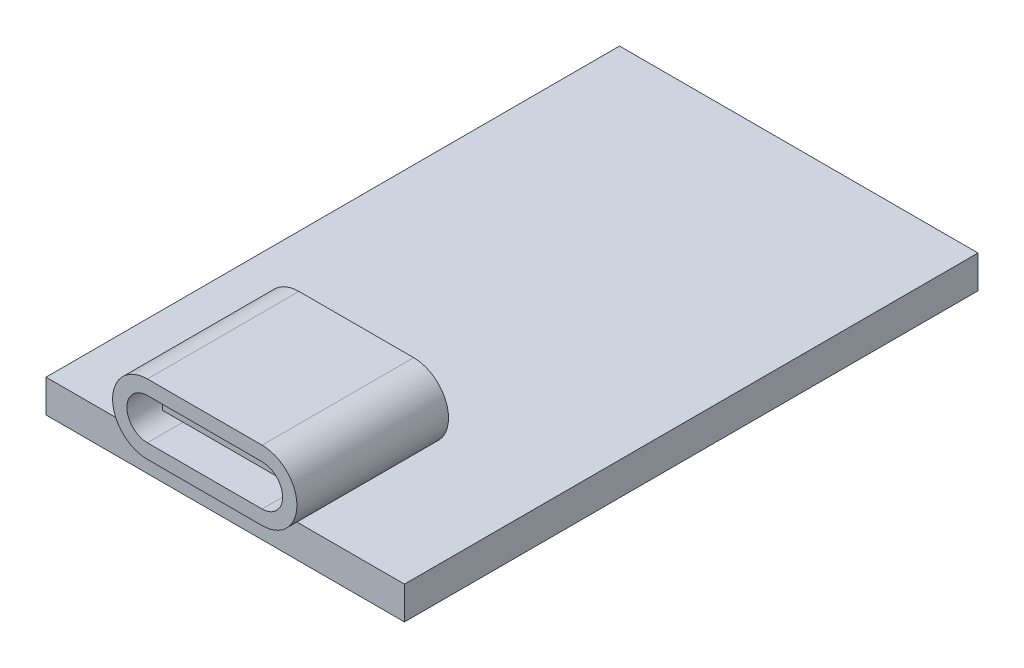
from build123d import *

# Parameters (mm, degrees)
SKETCH1_W                = 17.5
SKETCH1_H                = 28
BOSS_EXTRUDE1_DEPTH      = 1.6
BOSS_EXTRUDE2_DEPTH      = 1
BOSS_EXTRUDE2_DEPTH_BACK = 6.4
CUT_EXTRUDE1_DEPTH       = 6
SKETCH4_W                = 6.110016504
SKETCH4_H                = 0.488801321
BOSS_EXTRUDE3_DEPTH      = 5


with BuildPart() as part:
    # Sketch1 → Boss-Extrude1 (new body)
    with BuildSketch(Plane(origin=(0, 0, 0), x_dir=(1, 0, 0), z_dir=(0, 1, 0))):
        with Locations((8.75, 14)):
            Rectangle(SKETCH1_W, SKETCH1_H)
    extrude(amount=BOSS_EXTRUDE1_DEPTH)

    # Sketch2 → Boss-Extrude2 (add, two sides: drawn at the far end of the back side and taken through both)
    with BuildSketch(Plane.XY.offset(-BOSS_EXTRUDE2_DEPTH_BACK)):
        with BuildLine():
            Line((5.95, 5), (11.55, 5))
            ThreePointArc((11.55, 5), (13.25, 3.3), (11.55, 1.6))
            Line((11.55, 1.6), (5.95, 1.6))
            ThreePointArc((5.95, 1.6), (4.25, 3.3), (5.95, 5))
        make_face()
    extrude(amount=BOSS_EXTRUDE2_DEPTH + BOSS_EXTRUDE2_DEPTH_BACK)

    # Sketch3 → Cut-Extrude1 (cut)
    with BuildSketch(Plane.XY.offset(1)):
        with BuildLine():
            Line((11.55, 2.3), (5.95, 2.3))
            ThreePointArc((5.95, 2.3), (4.95, 3.3), (5.95, 4.3))
            Line((5.95, 4.3), (11.55, 4.3))
            ThreePointArc((11.55, 4.3), (12.55, 3.3), (11.55, 2.3))
        make_face()
    extrude(amount=-CUT_EXTRUDE1_DEPTH, mode=Mode.SUBTRACT)

    # Sketch4 → Boss-Extrude3 (add)
    with BuildSketch(Plane.XY.offset(-5)):
        with Locations((8.750272331, 3.285790187)):
            Rectangle(SKETCH4_W, SKETCH4_H)
    extrude(amount=BOSS_EXTRUDE3_DEPTH)


solid = part.part
